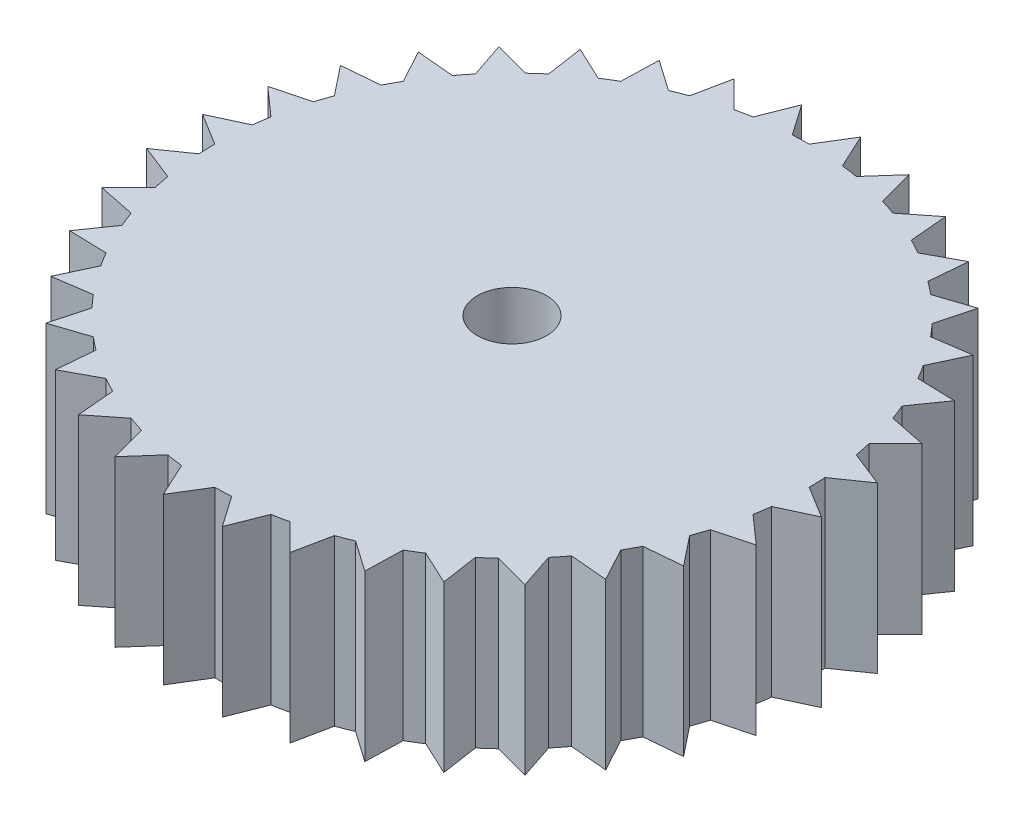
from build123d import *

# Parameters (mm, degrees)
SKETCH1_R           = 9
BOSS_EXTRUDE1_DEPTH = 5
SKETCH2_R           = 2.5
CUT_EXTRUDE1_DEPTH  = 3
CUT_EXTRUDE1_DRAFT  = -3
SKETCH3_R           = 1.05
CUT_EXTRUDE2_DEPTH  = 3
BOSS_EXTRUDE2_DEPTH = 5


with BuildPart() as part:
    # Sketch1 → Boss-Extrude1 (new body)
    with BuildSketch(Plane(origin=(0, 0, 0), x_dir=(1, 0, 0), z_dir=(0, 1, 0))):
        with Locations(Location((0, 0, 0), (0, 0, 270))):
            Circle(SKETCH1_R)
    extrude(amount=BOSS_EXTRUDE1_DEPTH)


with BuildPart() as cut_extrude1_tool:
    # Sketch2 → Cut-Extrude1 (with draft: the straight prism first)
    with BuildSketch(Plane.XZ):
        Circle(SKETCH2_R)
    extrude(amount=-CUT_EXTRUDE1_DEPTH)
    # Cut-Extrude1: the draft: its side faces are tilted about the plane it starts from
    cut_extrude1_sides = [cut_extrude1_tool.faces().sort_by_distance(p)[0] for p in [
        (-2.5, 1.5, 0),
    ]]
    draft(cut_extrude1_sides, Plane.XZ, CUT_EXTRUDE1_DRAFT)


with BuildPart() as part_1:
    add(part.part)

    # Cut-Extrude1: cut by cut_extrude1_tool
    add(cut_extrude1_tool.part, mode=Mode.SUBTRACT)

    # Sketch3 → Cut-Extrude2 (cut)
    with BuildSketch(Plane.XZ.offset(-3)):
        with Locations(Location((0, 0, 0), (0, 0, 270))):
            Circle(SKETCH3_R)
    extrude(amount=-CUT_EXTRUDE2_DEPTH, mode=Mode.SUBTRACT)

    # Sketch4 → Boss-Extrude2 (add)
    with BuildSketch(Plane(origin=(0, 5, 0), x_dir=(1, 0, 0), z_dir=(0, 1, 0))):
        Polygon((0, 9), (0.59385284, 9.966251069), (1.073329801, 8.935768749), align=None)
        Polygon((1.562833599, 8.863269777), (2.315452217, 9.711719857), (2.608703469, 8.613632579), align=None)
        Polygon((3.07818129, 8.457233587), (3.966697751, 9.162102953), (4.064813002, 8.029775542), align=None)
        Polygon((4.5, 7.794228634), (5.49741718, 8.334100186), (5.397415249, 7.201937839), align=None)
        Polygon((5.785088487, 6.894399988), (6.86110037, 7.252870002), (6.566019765, 6.155272898), align=None)
        Polygon((6.894399988, 5.785088487), (8.016312498, 5.951265034), (7.535119092, 4.921583105), align=None)
        Polygon((7.794228634, 4.5), (8.927953026, 4.468833889), (8.27526764, 3.5383535), align=None)
        Polygon((8.457233587, 3.07818129), (9.56832222, 2.850619487), (8.763976367, 2.047612815), align=None)
        Polygon((8.863269777, 1.562833599), (9.917962784, 1.145790455), (8.986396107, 0.49465645), align=None)
        Polygon((9, 0), (9.966251069, -0.59385284), (8.935768749, -1.073329801), align=None)
        Polygon((8.863269777, -1.562833599), (9.711719857, -2.315452217), (8.613632579, -2.608703469), align=None)
        Polygon((8.457233587, -3.07818129), (9.162102953, -3.966697751), (8.029775542, -4.064813002), align=None)
        Polygon((7.794228634, -4.5), (8.334100186, -5.49741718), (7.201937839, -5.397415249), align=None)
        Polygon((6.894399988, -5.785088487), (7.252870002, -6.86110037), (6.155272898, -6.566019765), align=None)
        Polygon((5.785088487, -6.894399988), (5.951265034, -8.016312498), (4.921583105, -7.535119092), align=None)
        Polygon((4.5, -7.794228634), (4.468833889, -8.927953026), (3.5383535, -8.27526764), align=None)
        Polygon((3.07818129, -8.457233587), (2.850619487, -9.56832222), (2.047612815, -8.763976367), align=None)
        Polygon((1.562833599, -8.863269777), (1.145790455, -9.917962784), (0.49465645, -8.986396107), align=None)
        Polygon((0, -9), (-0.59385284, -9.966251069), (-1.073329801, -8.935768749), align=None)
        Polygon((-1.562833599, -8.863269777), (-2.315452217, -9.711719857), (-2.608703469, -8.613632579), align=None)
        Polygon((-3.07818129, -8.457233587), (-3.966697751, -9.162102953), (-4.064813002, -8.029775542), align=None)
        Polygon((-4.5, -7.794228634), (-5.49741718, -8.334100186), (-5.397415249, -7.201937839), align=None)
        Polygon((-5.785088487, -6.894399988), (-6.86110037, -7.252870002), (-6.566019765, -6.155272898), align=None)
        Polygon((-6.894399988, -5.785088487), (-8.016312498, -5.951265034), (-7.535119092, -4.921583105), align=None)
        Polygon((-7.794228634, -4.5), (-8.927953026, -4.468833889), (-8.27526764, -3.5383535), align=None)
        Polygon((-8.457233587, -3.07818129), (-9.56832222, -2.850619487), (-8.763976367, -2.047612815), align=None)
        Polygon((-8.863269777, -1.562833599), (-9.917962784, -1.145790455), (-8.986396107, -0.49465645), align=None)
        Polygon((-9, 0), (-9.966251069, 0.59385284), (-8.935768749, 1.073329801), align=None)
        Polygon((-8.863269777, 1.562833599), (-9.711719857, 2.315452217), (-8.613632579, 2.608703469), align=None)
        Polygon((-8.457233587, 3.07818129), (-9.162102953, 3.966697751), (-8.029775542, 4.064813002), align=None)
        Polygon((-7.794228634, 4.5), (-8.334100186, 5.49741718), (-7.201937839, 5.397415249), align=None)
        Polygon((-6.894399988, 5.785088487), (-7.252870002, 6.86110037), (-6.155272898, 6.566019765), align=None)
        Polygon((-5.785088487, 6.894399988), (-5.951265034, 8.016312498), (-4.921583105, 7.535119092), align=None)
        Polygon((-4.5, 7.794228634), (-4.468833889, 8.927953026), (-3.5383535, 8.27526764), align=None)
        Polygon((-3.07818129, 8.457233587), (-2.850619487, 9.56832222), (-2.047612815, 8.763976367), align=None)
        Polygon((-1.562833599, 8.863269777), (-1.145790455, 9.917962784), (-0.49465645, 8.986396107), align=None)
    extrude(amount=-BOSS_EXTRUDE2_DEPTH)


solid = part_1.part
